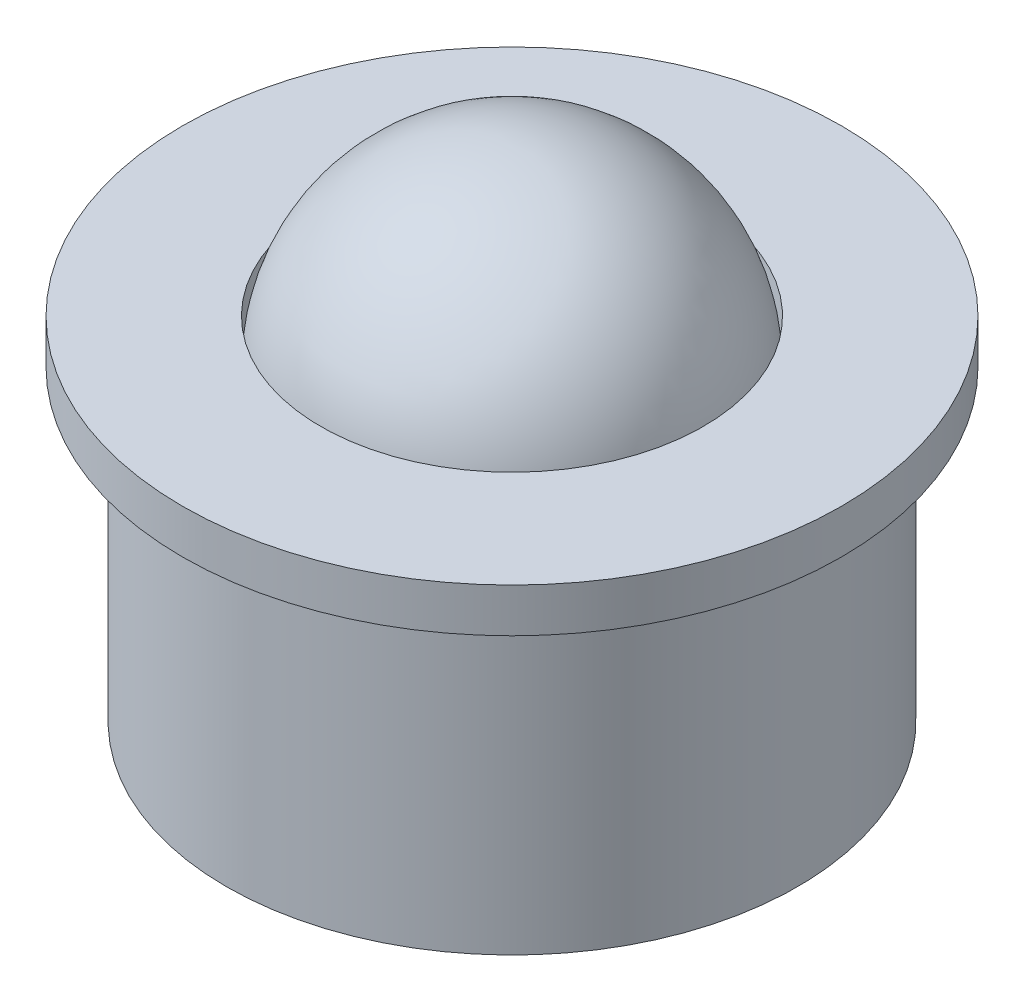
from build123d import *

# Parameters (mm, degrees)
REVOLVE_1_ANGLE = 180
SKETCH_5_R      = 7.5
SKETCH_5_R_2    = 4.355
EXTRUDE_1_DEPTH = 1
SKETCH_5_4_R    = 6.5
SKETCH_5_4_R_2  = 5.5
EXTRUDE_2_DEPTH = 7


with BuildPart() as part:
    # 草图1 → 旋转1 (revolve)
    with BuildSketch(Plane(origin=(0, 0, 0), x_dir=(1, 0, 0), z_dir=(0, 1, 0))):
        with BuildLine():
            Line((-4.355, 0), (4.355, 0))
            ThreePointArc((4.355, 0), (0, 4.355), (-4.355, 0))
        make_face()
    revolve(axis=Axis((-4.355, 0, 0), (1, 0, 0)), revolution_arc=REVOLVE_1_ANGLE)


with BuildPart() as body_2:
    # 草图5 → 凸台-拉伸1 (new body)
    with BuildSketch(Plane.XZ):
        Circle(SKETCH_5_R)
        Circle(SKETCH_5_R_2, mode=Mode.SUBTRACT)
    extrude(amount=-EXTRUDE_1_DEPTH)

    # 草图5<4> → 凸台-拉伸2 (add)
    with BuildSketch(Plane.XZ):
        Circle(SKETCH_5_4_R)
        Circle(SKETCH_5_4_R_2, mode=Mode.SUBTRACT)
    extrude(amount=EXTRUDE_2_DEPTH)


solid = Compound([part.part, body_2.part])
